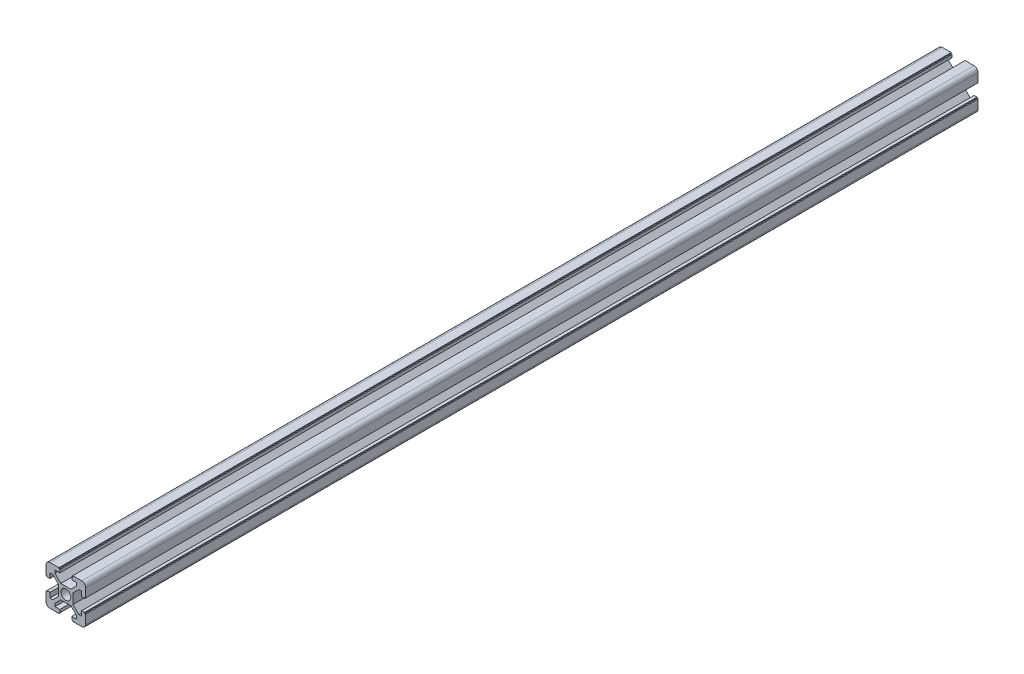
from build123d import *

# Parameters (mm, degrees)
SKETCH1_R           = 2.5
BOSS_EXTRUDE1_DEPTH = 450


with BuildPart() as part:
    # Sketch1 → Boss-Extrude1 (new body)
    with BuildSketch(Plane.XY):
        with BuildLine():
            Line((8, -3), (8, -5.5))
            Line((8, -5.5), (6.560660172, -5.5))
            Line((6.560660172, -5.5), (3.6, -2.539339828))
            Line((3.6, -2.539339828), (3.6, 2.539339828))
            Line((3.6, 2.539339828), (6.560660172, 5.5))
            Line((6.560660172, 5.5), (8, 5.5))
            Line((8, 5.5), (8, 3))
            Line((8, 3), (9.5, 3))
            Line((9.5, 3), (9.5, 3.5))
            Line((9.5, 3.5), (10, 3.5))
            Line((10, 3.5), (10, 8))
            ThreePointArc((10, 8), (9.414213562, 9.414213562), (8, 10))
            Line((8, 10), (3.5, 10))
            Line((3.5, 10), (3.5, 9.5))
            Line((3.5, 9.5), (3, 9.5))
            Line((3, 9.5), (3, 8))
            Line((3, 8), (5.5, 8))
            Line((5.5, 8), (5.5, 6.560660172))
            Line((5.5, 6.560660172), (2.539339828, 3.6))
            Line((2.539339828, 3.6), (-2.539339828, 3.6))
            Line((-2.539339828, 3.6), (-5.5, 6.560660172))
            Line((-5.5, 6.560660172), (-5.5, 8))
            Line((-5.5, 8), (-3, 8))
            Line((-3, 8), (-3, 9.5))
            Line((-3, 9.5), (-3.5, 9.5))
            Line((-3.5, 9.5), (-3.5, 10))
            Line((-3.5, 10), (-8, 10))
            ThreePointArc((-8, 10), (-9.414213562, 9.414213562), (-10, 8))
            Line((-10, 8), (-10, 3.5))
            Line((-10, 3.5), (-9.5, 3.5))
            Line((-9.5, 3.5), (-9.5, 3))
            Line((-9.5, 3), (-8, 3))
            Line((-8, 3), (-8, 5.5))
            Line((-8, 5.5), (-6.560660172, 5.5))
            Line((-6.560660172, 5.5), (-3.6, 2.539339828))
            Line((-3.6, 2.539339828), (-3.6, -2.539339828))
            Line((-3.6, -2.539339828), (-6.560660172, -5.5))
            Line((-6.560660172, -5.5), (-8, -5.5))
            Line((-8, -5.5), (-8, -3))
            Line((-8, -3), (-9.5, -3))
            Line((-9.5, -3), (-9.5, -3.5))
            Line((-9.5, -3.5), (-10, -3.5))
            Line((-10, -3.5), (-10, -8))
            ThreePointArc((-10, -8), (-9.414213562, -9.414213562), (-8, -10))
            Line((-8, -10), (-3.5, -10))
            Line((-3.5, -10), (-3.5, -9.5))
            Line((-3.5, -9.5), (-3, -9.5))
            Line((-3, -9.5), (-3, -8))
            Line((-3, -8), (-5.5, -8))
            Line((-5.5, -8), (-5.5, -6.560660172))
            Line((-5.5, -6.560660172), (-2.539339828, -3.6))
            Line((-2.539339828, -3.6), (2.539339828, -3.6))
            Line((2.539339828, -3.6), (5.5, -6.560660172))
            Line((5.5, -6.560660172), (5.5, -8))
            Line((5.5, -8), (3, -8))
            Line((3, -8), (3, -9.5))
            Line((3, -9.5), (3.5, -9.5))
            Line((3.5, -9.5), (3.5, -10))
            Line((3.5, -10), (8, -10))
            ThreePointArc((8, -10), (9.414213562, -9.414213562), (10, -8))
            Line((10, -8), (10, -3.5))
            Line((10, -3.5), (9.5, -3.5))
            Line((9.5, -3.5), (9.5, -3))
            Line((9.5, -3), (8, -3))
        make_face()
        Circle(SKETCH1_R, mode=Mode.SUBTRACT)
    extrude(amount=BOSS_EXTRUDE1_DEPTH)


solid = part.part
